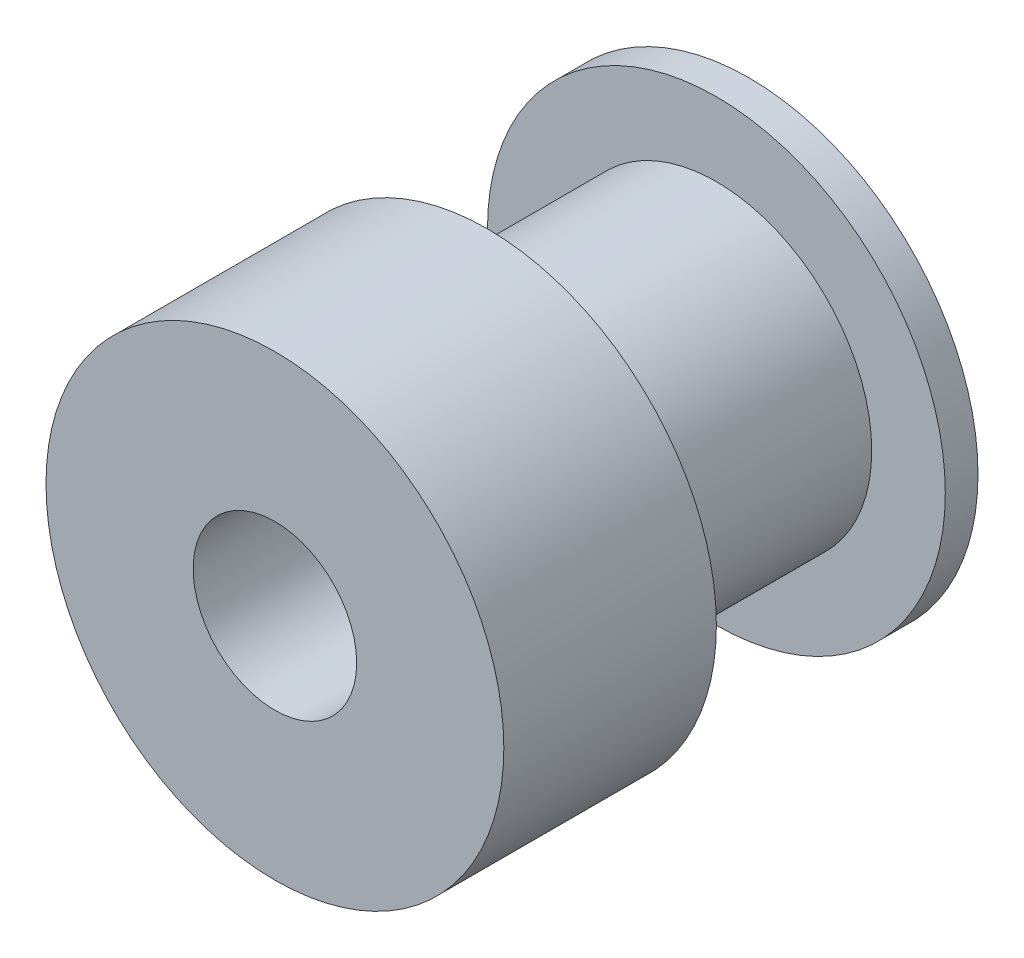
from build123d import *

# Parameters (mm, degrees)
SKETCH_1_R          = 7
EXTRUDE_1_DEPTH     = 1
SKETCH_2_R          = 4.75
EXTRUDE_2_DEPTH     = 7
SKETCH_3_R          = 7
EXTRUDE_3_DEPTH     = 6.5
SKETCH_4_R          = 2.5
CUT_EXTRUDE_1_DEPTH = 16


with BuildPart() as part:
    # 草图1 → 凸台-拉伸1 (new body)
    with BuildSketch(Plane.XY):
        Circle(SKETCH_1_R)
    extrude(amount=EXTRUDE_1_DEPTH)

    # 草图2 → 凸台-拉伸2 (add)
    with BuildSketch(Plane.XY.offset(1)):
        Circle(SKETCH_2_R)
    extrude(amount=EXTRUDE_2_DEPTH)

    # 草图3 → 凸台-拉伸3 (add)
    with BuildSketch(Plane.XY.offset(8)):
        Circle(SKETCH_3_R)
    extrude(amount=EXTRUDE_3_DEPTH)

    # 草图4 → 切除-拉伸1 (cut)
    with BuildSketch(Plane.XY.offset(14.5)):
        Circle(SKETCH_4_R)
    extrude(amount=-CUT_EXTRUDE_1_DEPTH, mode=Mode.SUBTRACT)


solid = part.part
